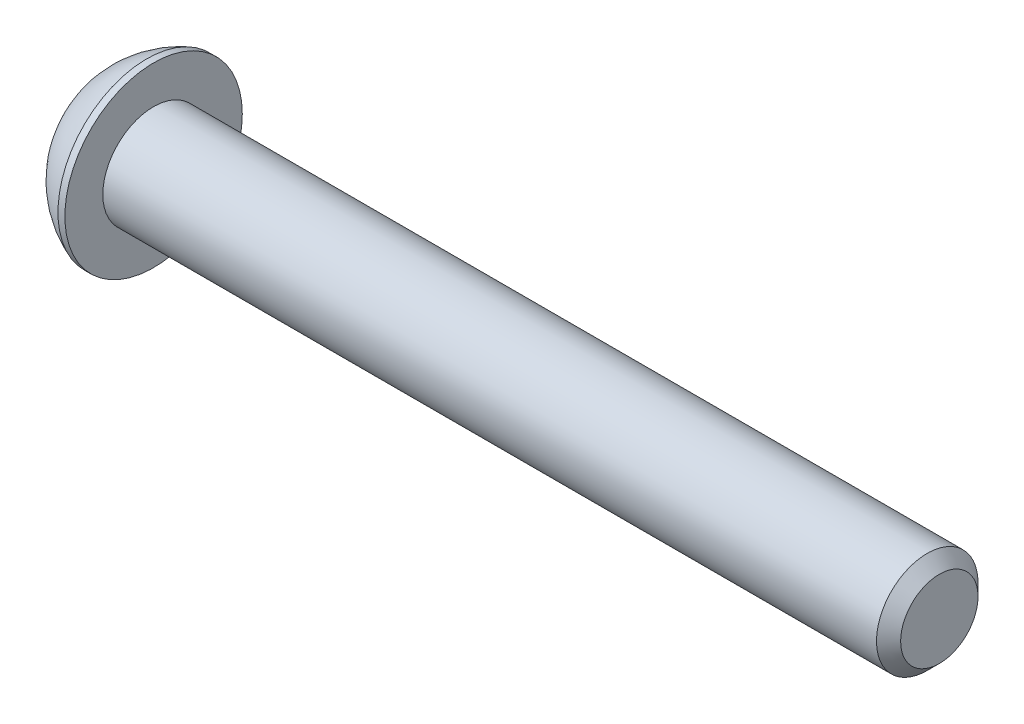
from build123d import *

# Parameters (mm, degrees)
SKETCH2_R           = 3.175
BOSS_EXTRUDE1_DEPTH = 49.149
CUT_EXTRUDE1_DEPTH  = 2.2225
CHAMFER1_SIZE       = 0.75565


with BuildPart() as part:
    # Sketch1 → Revolve1 (revolve)
    with BuildSketch(Plane.XY, mode=Mode.PRIVATE) as revolve1_sk:
        with BuildLine():
            Line((-3.3528, 3.175), (-3.3528, 0))
            Line((-3.3528, 0), (0, 0))
            Line((0, 0), (0, 5.5499))
            Line((0, 5.5499), (-0.4318, 5.5499))
            ThreePointArc((-0.4318, 5.5499), (-2.086170702, 4.600900596), (-3.3528, 3.175))
        make_face()
    revolve(revolve1_sk.sketch.rotate(Axis((-3.3528, 0, 0), (1, 0, 0)), 270), axis=Axis((-3.3528, 0, 0), (1, 0, 0)))

    # Sketch2 → Boss-Extrude1 (add)
    with BuildSketch(Plane(origin=(0, 0, 0), x_dir=(0, 0, -1), z_dir=(1, 0, 0))):
        with Locations(Location((0, 0, 0), (0, 0, 180))):
            Circle(SKETCH2_R)
    extrude(amount=BOSS_EXTRUDE1_DEPTH)

    # Sketch3 → Cut-Extrude1 (cut)
    with BuildSketch(Plane.ZY.offset(3.3528)):
        Polygon((2.291358881, 0), (1.14567944, 1.984375), (-1.14567944, 1.984375), (-2.291358881, 0), (-1.14567944, -1.984375), (1.14567944, -1.984375), align=None)
    extrude(amount=-CUT_EXTRUDE1_DEPTH, mode=Mode.SUBTRACT)

    # Chamfer1
    chamfer1_edges = [part.edges().sort_by_distance(p)[0] for p in [
        (49.149, 0, -3.175),
    ]]
    chamfer(chamfer1_edges, length=CHAMFER1_SIZE)


solid = part.part
